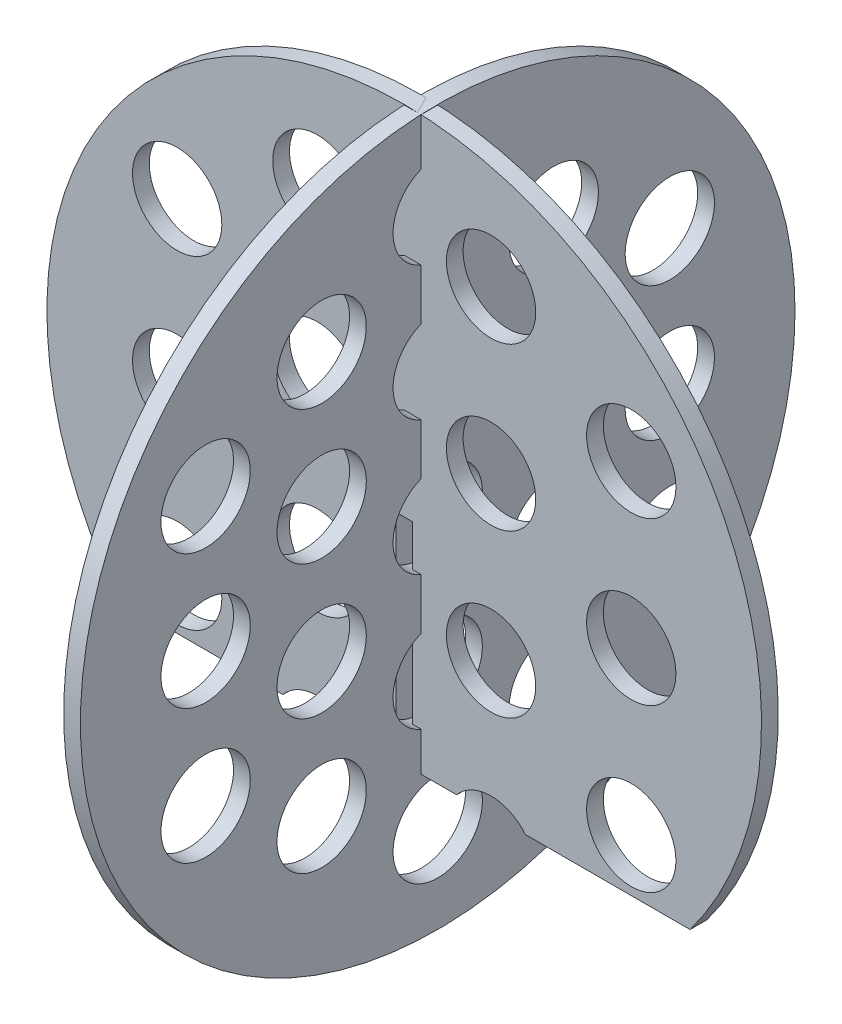
from build123d import *

# Parameters (mm, degrees)
SKETCH1_R               = 32
SKETCH1_R_2             = 4
BOSS_EXTRUDE1_DEPTH     = 1.5
SKETCH2_R               = 4
BOSS_EXTRUDE2_DEPTH     = 1.5
CUT_EXTRUDE2_DEPTH      = 57.304973137
CUT_EXTRUDE2_DEPTH_BACK = 57.304973137
SKETCH3_W               = 100
SKETCH3_H               = 12.8


with BuildPart() as part:
    # Sketch1 → Boss-Extrude1 (new body)
    with BuildSketch(Plane(origin=(0, 0, 0), x_dir=(0, 0, -1), z_dir=(1, 0, 0))):
        Circle(SKETCH1_R)
        Circle(SKETCH1_R_2, mode=Mode.SUBTRACT)
        with Locations((0, 12)):
            Circle(SKETCH1_R_2, mode=Mode.SUBTRACT)
        with Locations((10.392304845, 6)):
            Circle(SKETCH1_R_2, mode=Mode.SUBTRACT)
        with Locations((10.392304845, -6)):
            Circle(SKETCH1_R_2, mode=Mode.SUBTRACT)
        with Locations((0, -12)):
            Circle(SKETCH1_R_2, mode=Mode.SUBTRACT)
        with Locations((-10.392304845, -6)):
            Circle(SKETCH1_R_2, mode=Mode.SUBTRACT)
        with Locations((-10.392304845, 6)):
            Circle(SKETCH1_R_2, mode=Mode.SUBTRACT)
        with Locations((10.392304845, 18)):
            Circle(SKETCH1_R_2, mode=Mode.SUBTRACT)
        with Locations(Location((20.784609691, 0, 0), (0, 0, 180))):
            Circle(SKETCH1_R_2, mode=Mode.SUBTRACT)
        with Locations(Location((20.784609691, 12, 0), (0, 0, 180))):
            Circle(SKETCH1_R_2, mode=Mode.SUBTRACT)
        with Locations((0, 24)):
            Circle(SKETCH1_R_2, mode=Mode.SUBTRACT)
        with Locations((20.784609691, -12)):
            Circle(SKETCH1_R_2, mode=Mode.SUBTRACT)
        with Locations((10.392304845, -18)):
            Circle(SKETCH1_R_2, mode=Mode.SUBTRACT)
        with Locations(Location((0, -24, 0), (0, 0, 180))):
            Circle(SKETCH1_R_2, mode=Mode.SUBTRACT)
        with Locations(Location((-10.392304845, -18, 0), (0, 0, 180))):
            Circle(SKETCH1_R_2, mode=Mode.SUBTRACT)
        with Locations((-20.784609691, -12)):
            Circle(SKETCH1_R_2, mode=Mode.SUBTRACT)
        with Locations((-20.784609691, 0)):
            Circle(SKETCH1_R_2, mode=Mode.SUBTRACT)
        with Locations(Location((-20.784609691, 12, 0), (0, 0, 180))):
            Circle(SKETCH1_R_2, mode=Mode.SUBTRACT)
        with Locations(Location((-10.392304845, 18, 0), (0, 0, 180))):
            Circle(SKETCH1_R_2, mode=Mode.SUBTRACT)
    extrude(amount=BOSS_EXTRUDE1_DEPTH)


with BuildPart() as body_2:
    # Sketch2 → Boss-Extrude2 (new body)
    with BuildSketch(Plane.XY):
        with BuildLine():
            ThreePointArc((32, 0), (-22.360679775, 22.891046285), (-0.75, -31.99120973))
            Line((-0.75, -31.99120973), (-0.75, 0))
            Line((-0.75, 0), (0.75, 0))
            Line((0.75, 0), (0.75, -31.99120973))
            ThreePointArc((0.75, -31.99120973), (22.891046285, -22.360679775), (32, 0))
        make_face()
        with Locations((-7.776053053, -21.75)):
            Circle(SKETCH2_R, mode=Mode.SUBTRACT)
        with Locations((-20.333421407, -14.5)):
            Circle(SKETCH2_R, mode=Mode.SUBTRACT)
        with Locations((-7.776053053, -7.25)):
            Circle(SKETCH2_R, mode=Mode.SUBTRACT)
        with Locations((7.776053053, -21.75)):
            Circle(SKETCH2_R, mode=Mode.SUBTRACT)
        with Locations((7.776053053, -7.25)):
            Circle(SKETCH2_R, mode=Mode.SUBTRACT)
        with Locations((20.333421407, -14.5)):
            Circle(SKETCH2_R, mode=Mode.SUBTRACT)
        with Locations((-20.333421407, 0)):
            Circle(SKETCH2_R, mode=Mode.SUBTRACT)
        with Locations((-20.333421407, 14.5)):
            Circle(SKETCH2_R, mode=Mode.SUBTRACT)
        with Locations((-7.776053053, 7.25)):
            Circle(SKETCH2_R, mode=Mode.SUBTRACT)
        with Locations((-7.776053053, 21.75)):
            Circle(SKETCH2_R, mode=Mode.SUBTRACT)
        with Locations((7.776053053, 7.25)):
            Circle(SKETCH2_R, mode=Mode.SUBTRACT)
        with Locations((20.333421407, 0)):
            Circle(SKETCH2_R, mode=Mode.SUBTRACT)
        with Locations((20.333421407, 14.5)):
            Circle(SKETCH2_R, mode=Mode.SUBTRACT)
        with Locations((7.776053053, 21.75)):
            Circle(SKETCH2_R, mode=Mode.SUBTRACT)
    extrude(amount=BOSS_EXTRUDE2_DEPTH)

    # Sketch3 → Cut-Extrude2 (cut, two sides: drawn at the far end of the back side and taken through both)
    with BuildSketch(Plane.XY.offset(1.5).offset(-CUT_EXTRUDE2_DEPTH_BACK)):
        with Locations((0, -25.6)):
            Rectangle(SKETCH3_W, SKETCH3_H)
    extrude(amount=CUT_EXTRUDE2_DEPTH + CUT_EXTRUDE2_DEPTH_BACK, mode=Mode.SUBTRACT)


solid = Compound([part.part, body_2.part])
